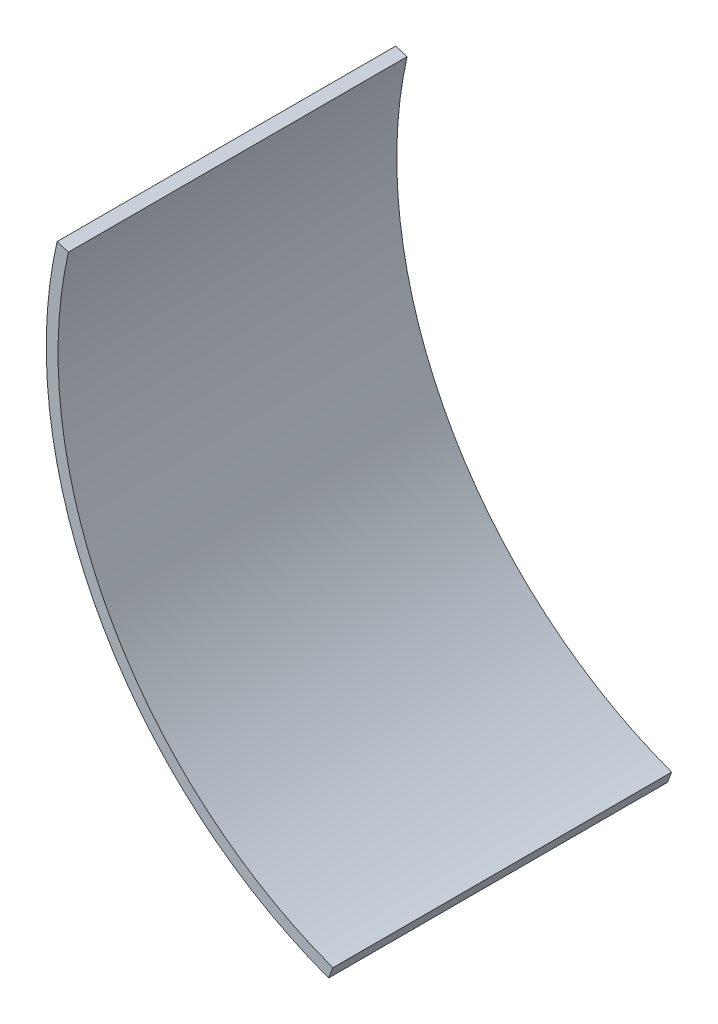
from build123d import *

# Parameters (mm, degrees)
Y_KSEKLIK_EKSTR_ZYON1_DEPTH = 430


with BuildPart() as part:
    # Model → Yükseklik-Ekstrüzyon1 (new body)
    with BuildSketch(Plane.XY):
        with BuildLine():
            ThreePointArc((2707.809953619, 1930.413382125), (2760.236519974, 1546.882218038), (3052.559283903, 1293.126232147))
            Line((3052.559283903, 1293.126232147), (3057.997199689, 1307.107962051))
            ThreePointArc((3057.997199689, 1307.107962051), (2773.778742407, 1553.375276393), (2722.163894248, 1925.885180989))
            Line((2722.163894248, 1925.885180989), (2707.809953619, 1930.413382126))
        make_face()
    extrude(amount=Y_KSEKLIK_EKSTR_ZYON1_DEPTH)


solid = part.part
